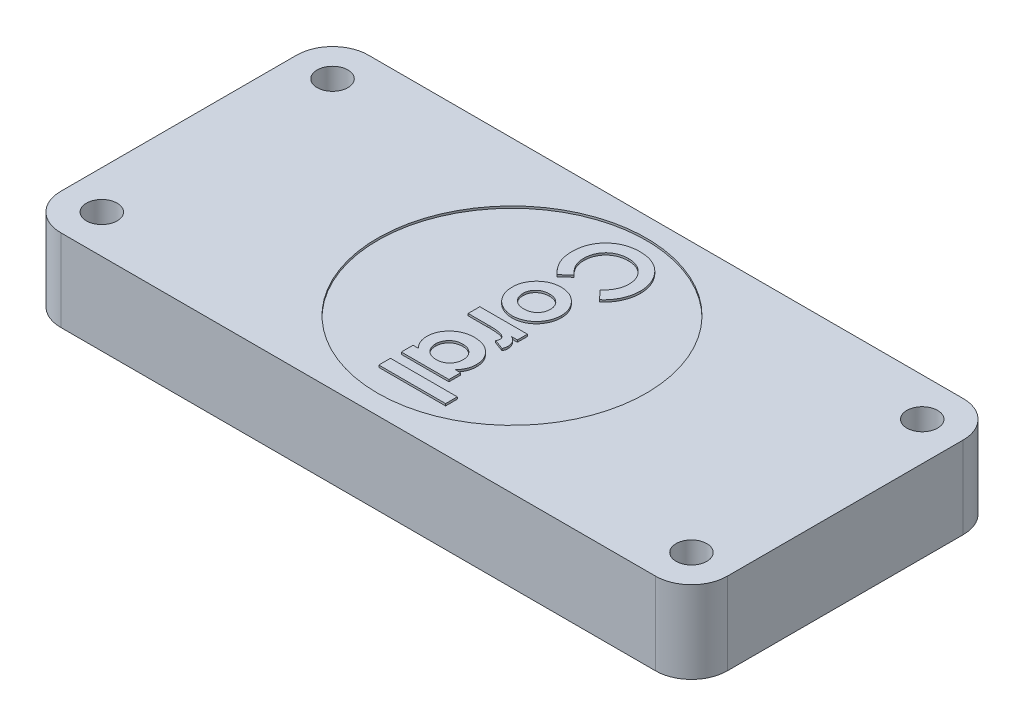
from build123d import *

# Parameters (mm, degrees)
SKETCH1_W           = 65
SKETCH1_H           = 30
SKETCH1_R           = 1.5
BOSS_EXTRUDE1_DEPTH = 8
FILLET1_R           = 3.5
SKETCH2_R           = 13.103694402
SKETCH2_W           = 6.512820512
SKETCH2_H           = 1.13974359
CUT_EXTRUDE1_DEPTH  = 0.2


with BuildPart() as part:
    # Sketch1 → Boss-Extrude1 (new body)
    with BuildSketch(Plane(origin=(0, 0, 0), x_dir=(1, 0, 0), z_dir=(0, 1, 0))):
        Rectangle(SKETCH1_W, SKETCH1_H)
        with Locations(Location((-28.75, 11.25, 0), (0, 0, 270))):
            Circle(SKETCH1_R, mode=Mode.SUBTRACT)
        with Locations(Location((-28.75, -11.25, 0), (0, 0, 90))):
            Circle(SKETCH1_R, mode=Mode.SUBTRACT)
        with Locations(Location((28.75, 11.25, 0), (0, 0, 90))):
            Circle(SKETCH1_R, mode=Mode.SUBTRACT)
        with Locations(Location((28.75, -11.25, 0), (0, 0, 270))):
            Circle(SKETCH1_R, mode=Mode.SUBTRACT)
    extrude(amount=BOSS_EXTRUDE1_DEPTH)

    # Fillet1
    fillet1_edges = [part.edges().sort_by_distance(p)[0] for p in [
        (32.5, 4, 15),
        (-32.5, 4, 15),
        (-32.5, 4, -15),
        (32.5, 4, -15),
    ]]
    fillet(fillet1_edges, radius=FILLET1_R)

    # Sketch2 → Cut-Extrude1 (cut)
    # profile 1 of 3: a face of its own
    with BuildSketch(Plane(origin=(0, 8, 0), x_dir=(1, 0, 0), z_dir=(0, 1, 0))):
        with Locations(Location((0, 0, 0), (0, 0, 270))):
            Circle(SKETCH2_R)
        with Locations((0.932401843, -10.094871795)):
            Rectangle(SKETCH2_W, SKETCH2_H, mode=Mode.SUBTRACT)
        with BuildLine():
            add(Edge.make_bspline(
                [(0.861167869, 11.641666667), (1.015981783, 11.643008743), (1.24450499, 11.62762944), (1.5440518, 11.586339476), (1.758185007, 11.538226112), (1.967155075, 11.480132902), (2.168693631, 11.407912517), (2.363379156, 11.321652587), (2.551537767, 11.22414076), (2.73193677, 11.113826154), (2.903026267, 10.990592748), (3.066127035, 10.857612913), (3.21907524, 10.711691396), (3.363213796, 10.55494862), (3.497761593, 10.386676911), (3.624648177, 10.207888339), (3.740601531, 10.018098985), (3.845487275, 9.820995971), (3.938001815, 9.619065212), (4.015319611, 9.412803096), (4.079463181, 9.203080722), (4.127300543, 8.989015728), (4.176094506, 8.698007977), (4.187181091, 8.475380047), (4.188812099, 8.326742788)],
                knots=[0, 0, 0, 0, 0.088511806, 0.130925591, 0.172904037, 0.21400012, 0.25498502, 0.295291276, 0.335772442, 0.376180821, 0.416178408, 0.456350051, 0.496512167, 0.537040574, 0.578118744, 0.619724561, 0.66242197, 0.705298954, 0.747430001, 0.789432984, 0.831267421, 0.872825096, 0.91487011, 1, 1, 1, 1], degree=3))
            add(Edge.make_bspline(
                [(4.188812099, 8.326742788), (4.18893928, 8.199278713), (4.178639511, 8.008968181), (4.145000479, 7.757165377), (4.107331929, 7.571080942), (4.062552649, 7.385857795), (4.003938383, 7.20392949), (3.938597472, 7.022426151), (3.860497008, 6.844194308), (3.775242879, 6.668985361), (3.678519467, 6.500903198), (3.576277074, 6.337128185), (3.462471621, 6.181280406), (3.34120512, 6.030474623), (3.168053114, 5.836002635), (3.023707646, 5.702842213), (2.924409054, 5.617307692)],
                knots=[0, 0, 0, 0, 0.123904062, 0.185067241, 0.246840152, 0.30843533, 0.370241251, 0.432586589, 0.495924582, 0.559351071, 0.621942654, 0.684392867, 0.746985808, 0.809441465, 0.872507833, 1, 1, 1, 1], degree=3))
            Line((2.924409054, 5.617307692), (2.125570913, 6.453034856))
            add(Edge.make_bspline(
                [(2.125570913, 6.453034856), (2.270544811, 6.589015725), (2.474336548, 6.800961027), (2.689567452, 7.117633668), (2.822678529, 7.354047813), (2.92321409, 7.599171541), (3.021832779, 7.934609668), (3.049394057, 8.196549275), (3.04906851, 8.371264022)],
                knots=[0, 0, 0, 0, 0.272304448, 0.399525336, 0.522810878, 0.642662717, 0.761022621, 1, 1, 1, 1], degree=3))
            add(Edge.make_bspline(
                [(3.04906851, 8.371264022), (3.048036764, 8.516024709), (3.031411266, 8.731009319), (2.96354227, 9.006002515), (2.894662328, 9.201005753), (2.805445184, 9.386890371), (2.69605268, 9.5640407), (2.567447887, 9.732021406), (2.420302986, 9.888613279), (2.259535715, 10.031857712), (2.087997448, 10.158424488), (1.906081429, 10.264440114), (1.715628547, 10.351461459), (1.515762765, 10.419187845), (1.23287251, 10.484906656), (1.012193438, 10.500326903), (0.863711939, 10.501923077)],
                knots=[0, 0, 0, 0, 0.127706968, 0.188882163, 0.249158299, 0.309661029, 0.370224886, 0.432332222, 0.495781859, 0.559304077, 0.621860558, 0.683321537, 0.744522975, 0.806088371, 0.868994315, 1, 1, 1, 1], degree=3))
            add(Edge.make_bspline(
                [(0.863711939, 10.501923077), (0.759206696, 10.502427776), (0.60407157, 10.494491057), (0.401536113, 10.465612962), (0.256352994, 10.43487529), (0.1158728, 10.396387489), (-0.021115922, 10.351244904), (-0.152720417, 10.294610743), (-0.280469154, 10.231746803), (-0.400876357, 10.158636535), (-0.515694618, 10.079810237), (-0.624361109, 9.994335971), (-0.726431598, 9.901660134), (-0.820310951, 9.800478423), (-0.90882224, 9.693406013), (-0.989749696, 9.578636739), (-1.065124402, 9.458554654), (-1.130602708, 9.332122385), (-1.189914691, 9.202770392), (-1.23808013, 9.068537214), (-1.27692352, 8.931058051), (-1.309886906, 8.790821085), (-1.337481449, 8.596875468), (-1.348880386, 8.44924497), (-1.347085337, 8.349639423)],
                knots=[0, 0, 0, 0, 0.090639062, 0.134485273, 0.177331356, 0.219264833, 0.260785002, 0.302316572, 0.343435729, 0.384181474, 0.424375739, 0.464181122, 0.504011983, 0.543822462, 0.583802465, 0.624418535, 0.66554756, 0.70667494, 0.747826979, 0.788895117, 0.830219358, 0.871706937, 0.913733854, 1, 1, 1, 1], degree=3))
            add(Edge.make_bspline(
                [(-1.347085337, 8.349639423), (-1.346463629, 8.182916819), (-1.324283414, 7.935120966), (-1.239897428, 7.619515948), (-1.166645404, 7.433045795), (-1.094224556, 7.286948907), (-1.027250735, 7.175727573), (-0.95232872, 7.060717199), (-0.8666411, 6.943821811), (-0.77118892, 6.823752368), (-0.624453233, 6.657814836), (-0.50704784, 6.534182518), (-0.42358774, 6.453034856)],
                knots=[0, 0, 0, 0, 0.229969726, 0.340703508, 0.449355147, 0.505556512, 0.56530267, 0.628204956, 0.694728992, 0.765018834, 0.839580202, 1, 1, 1, 1], degree=3))
            Line((-0.42358774, 6.453034856), (-1.274579327, 5.642748397))
            add(Edge.make_bspline(
                [(-1.274579327, 5.642748397), (-1.381938819, 5.75376993), (-1.539177816, 5.917256717), (-1.72625556, 6.146067386), (-1.852725058, 6.309295362), (-1.965028432, 6.470943324), (-2.063278593, 6.630989995), (-2.14996022, 6.787624604), (-2.223611597, 6.94409946), (-2.286149047, 7.101388298), (-2.339990499, 7.263220018), (-2.385535324, 7.430089393), (-2.422295811, 7.603015449), (-2.451727391, 7.780385763), (-2.47876441, 8.027965297), (-2.487581948, 8.216729622), (-2.486828926, 8.344551282)],
                knots=[0, 0, 0, 0, 0.151815657, 0.222539839, 0.290277535, 0.354640607, 0.415797753, 0.474709008, 0.5304261, 0.585579746, 0.640906165, 0.697901091, 0.755420321, 0.814521258, 0.874461831, 1, 1, 1, 1], degree=3))
            add(Edge.make_bspline(
                [(-2.486828926, 8.344551282), (-2.485407305, 8.576064045), (-2.460811056, 8.918659681), (-2.360687505, 9.356930222), (-2.256993365, 9.663333067), (-2.124399726, 9.953439425), (-1.961879029, 10.227168486), (-1.76982772, 10.484080748), (-1.550506289, 10.722100614), (-1.308283601, 10.937400306), (-1.048202979, 11.127702603), (-0.768986325, 11.285112235), (-0.474757531, 11.415844517), (-0.164178017, 11.517955843), (0.280132838, 11.616141656), (0.626587725, 11.642120162), (0.861167869, 11.641666667)],
                knots=[0, 0, 0, 0, 0.131836579, 0.194461068, 0.255345968, 0.31558834, 0.375627452, 0.436137852, 0.49777862, 0.559470361, 0.62027777, 0.680787689, 0.741491622, 0.803215436, 0.866492763, 1, 1, 1, 1], degree=3))
        make_face(mode=Mode.SUBTRACT)
        with BuildLine():
            add(Edge.make_bspline(
                [(-0.007632212, 4.803205128), (0.164241203, 4.802936313), (0.41875111, 4.779736647), (0.744888514, 4.697212172), (0.974697824, 4.610192474), (1.19346598, 4.498832871), (1.474027124, 4.315496038), (1.660200467, 4.141625852), (1.775761218, 4.015815304)],
                knots=[0, 0, 0, 0, 0.256473689, 0.3792365, 0.500977689, 0.622366534, 0.744855131, 1, 1, 1, 1], degree=3))
            add(Edge.make_bspline(
                [(1.775761218, 4.015815304), (1.877612424, 3.905167025), (2.011792511, 3.726614171), (2.157280012, 3.471233194), (2.24615025, 3.275709153), (2.313008872, 3.072898694), (2.378786976, 2.792331554), (2.397170862, 2.575294863), (2.397786458, 2.42958734)],
                knots=[0, 0, 0, 0, 0.25846437, 0.382579777, 0.504990606, 0.627227493, 0.749296729, 1, 1, 1, 1], degree=3))
            add(Edge.make_bspline(
                [(2.397786458, 2.42958734), (2.397773344, 2.322903773), (2.388066956, 2.16322058), (2.353297812, 1.953882401), (2.319940824, 1.79960193), (2.27313793, 1.648634299), (2.217020337, 1.500188789), (2.152586786, 1.352937817), (2.07588944, 1.210536201), (1.992703892, 1.071955175), (1.900943483, 0.940572115), (1.801328872, 0.817478067), (1.696169724, 0.700387986), (1.580887748, 0.59475846), (1.461037714, 0.493839188), (1.332325813, 0.403082622), (1.197888459, 0.319055026), (1.058503063, 0.244246194), (0.915139292, 0.179287262), (0.769779062, 0.122913525), (0.620652484, 0.078757698), (0.4697234, 0.042262422), (0.262666443, 0.011113871), (0.105541426, -0.000624242), (0, 0)],
                knots=[0, 0, 0, 0, 0.084364343, 0.126142289, 0.167705805, 0.209066008, 0.25097289, 0.293148456, 0.336041456, 0.37876116, 0.420892731, 0.462622223, 0.503914433, 0.545187585, 0.586138136, 0.627721928, 0.669584534, 0.711432369, 0.752690541, 0.793970501, 0.834591739, 0.875576584, 0.916639513, 1, 1, 1, 1], degree=3))
            add(Edge.make_bspline(
                [(0, 0), (-0.106248238, 0.000139387), (-0.265116701, 0.009616766), (-0.47316723, 0.044485907), (-0.62657709, 0.077972911), (-0.776131374, 0.12460024), (-0.924033196, 0.179065062), (-1.068266966, 0.245926761), (-1.21040604, 0.319846295), (-1.346267725, 0.404414133), (-1.476269008, 0.495092144), (-1.596999347, 0.595588715), (-1.712202926, 0.700372648), (-1.817984073, 0.814414087), (-1.9160604, 0.935892717), (-2.007630905, 1.06375687), (-2.090547277, 1.198926023), (-2.163402632, 1.339668893), (-2.229088812, 1.483611847), (-2.283773105, 1.631596699), (-2.328382091, 1.783316755), (-2.362863969, 1.938865649), (-2.394615089, 2.152474293), (-2.405971679, 2.315182718), (-2.40541867, 2.424499199)],
                knots=[0, 0, 0, 0, 0.083839067, 0.125192329, 0.166335368, 0.207601958, 0.248670144, 0.290582404, 0.332926248, 0.374978427, 0.416740924, 0.457856759, 0.498808992, 0.539515963, 0.580420356, 0.621910028, 0.663502052, 0.705394285, 0.746863727, 0.788245389, 0.82973641, 0.871532383, 0.913824669, 1, 1, 1, 1], degree=3))
            add(Edge.make_bspline(
                [(-2.40541867, 2.424499199), (-2.403821135, 2.583285211), (-2.385877628, 2.819786411), (-2.311356413, 3.12321), (-2.234723971, 3.339294453), (-2.13642866, 3.546822244), (-2.014797737, 3.743976122), (-1.872199635, 3.932718851), (-1.709846752, 4.109780955), (-1.531730505, 4.271993441), (-1.341592514, 4.413707044), (-1.142282952, 4.534028), (-0.933572862, 4.63287396), (-0.71518242, 4.709090336), (-0.407990513, 4.783798649), (-0.168520779, 4.801651136), (-0.007632212, 4.803205128)],
                knots=[0, 0, 0, 0, 0.126883986, 0.188200706, 0.248894086, 0.309598788, 0.371125298, 0.433465539, 0.498143129, 0.562592753, 0.625474489, 0.687114454, 0.748124994, 0.809456656, 0.871431117, 1, 1, 1, 1], degree=3))
        make_face(mode=Mode.SUBTRACT)
        with BuildLine():
            add(Edge.make_bspline(
                [(1.317828526, -2.902784455), (1.346269587, -2.843494492), (1.397393829, -2.738868824), (1.420282537, -2.624407485), (1.420863381, -2.574599359)],
                knots=[0, 0, 0, 0, 0.570645018, 1, 1, 1, 1], degree=3))
            add(Edge.make_bspline(
                [(1.420863381, -2.574599359), (1.420806703, -2.532059477), (1.411399745, -2.466882792), (1.374533722, -2.387768586), (1.339310877, -2.329211959), (1.290279658, -2.276078498), (1.233534653, -2.222979308), (1.163469903, -2.176185064), (1.085485809, -2.12680369), (0.990032841, -2.084757242), (0.876081832, -2.048703425), (0.742314078, -2.016580554), (0.588019524, -1.994469651), (0.414690659, -1.973126548), (0.143596749, -1.955180696), (-0.069853668, -1.949027146), (-0.218790064, -1.950030048)],
                knots=[0, 0, 0, 0, 0.066912404, 0.101140702, 0.136380892, 0.173597996, 0.214075626, 0.25797978, 0.305417223, 0.358684712, 0.420923911, 0.492691001, 0.574130849, 0.665182153, 0.766512664, 1, 1, 1, 1], degree=3))
            Line((-0.218790064, -1.950030048), (-0.44521234, -1.953846154))
            Line((-0.44521234, -1.953846154), (-2.324008413, -1.953846154))
            Line((-2.324008413, -1.953846154), (-2.324008413, -0.814102564))
            Line((-2.324008413, -0.814102564), (2.316376202, -0.814102564))
            Line((2.316376202, -0.814102564), (2.316376202, -1.791025641))
            Line((2.316376202, -1.791025641), (1.745232372, -1.791025641))
            add(Edge.make_bspline(
                [(1.745232372, -1.791025641), (1.845220751, -1.842556491), (1.987806121, -1.930402954), (2.140497806, -2.085938373), (2.234016922, -2.210563371), (2.306771724, -2.34629825), (2.37674953, -2.537873243), (2.398932443, -2.690200201), (2.397786458, -2.792117388)],
                knots=[0, 0, 0, 0, 0.268422379, 0.39320538, 0.516430377, 0.637792883, 0.758061252, 1, 1, 1, 1], degree=3))
            add(Edge.make_bspline(
                [(2.397786458, -2.792117388), (2.396060909, -2.868115109), (2.378737278, -3.029329585), (2.317690019, -3.179598757), (2.283303285, -3.256410256)],
                knots=[0, 0, 0, 0, 0.474167851, 1, 1, 1, 1], degree=3))
            Line((2.283303285, -3.256410256), (1.317828526, -2.902784455))
        make_face(mode=Mode.SUBTRACT)
        with BuildLine():
            add(Edge.make_bspline(
                [(-0.012720353, -3.663461538), (0.156045959, -3.664802024), (0.406094287, -3.680034509), (0.726104406, -3.749794942), (0.949834735, -3.81955033), (1.161646727, -3.909354378), (1.361880786, -4.018710839), (1.550015217, -4.14912783), (1.722847562, -4.29940901), (1.881256251, -4.46167608), (2.019165448, -4.635273155), (2.136319018, -4.817485286), (2.231986205, -5.008507441), (2.305823445, -5.208307322), (2.379064737, -5.488525244), (2.39792752, -5.707710857), (2.397786458, -5.855178285)],
                knots=[0, 0, 0, 0, 0.139308968, 0.205473642, 0.26959838, 0.332253223, 0.394830003, 0.45737553, 0.520581844, 0.583374035, 0.644082429, 0.703039519, 0.761664045, 0.819843943, 0.878346403, 1, 1, 1, 1], degree=3))
            add(Edge.make_bspline(
                [(2.397786458, -5.855178285), (2.399385687, -5.99221338), (2.379105816, -6.195379182), (2.315794611, -6.45799979), (2.249311548, -6.646153515), (2.165150347, -6.82864604), (2.022986959, -7.063957964), (1.891940994, -7.226659369), (1.793569712, -7.326923077)],
                knots=[0, 0, 0, 0, 0.251537451, 0.373434128, 0.49566655, 0.617680221, 0.742091207, 1, 1, 1, 1], degree=3))
            Line((1.793569712, -7.326923077), (2.316376202, -7.326923077))
            Line((2.316376202, -7.326923077), (2.316376202, -8.466666667))
            Line((2.316376202, -8.466666667), (-2.324008413, -8.466666667))
            Line((-2.324008413, -8.466666667), (-2.324008413, -7.326923077))
            Line((-2.324008413, -7.326923077), (-1.817738381, -7.326923077))
            add(Edge.make_bspline(
                [(-1.817738381, -7.326923077), (-1.915117736, -7.219105365), (-2.048735672, -7.052868149), (-2.189096918, -6.814912643), (-2.270669293, -6.640399629), (-2.330810421, -6.461831998), (-2.3899556, -6.213440936), (-2.404545398, -6.019774106), (-2.40541867, -5.889523237)],
                knots=[0, 0, 0, 0, 0.273943506, 0.399987178, 0.519718967, 0.636176176, 0.754371141, 1, 1, 1, 1], degree=3))
            add(Edge.make_bspline(
                [(-2.40541867, -5.889523237), (-2.406995335, -5.742600806), (-2.384504248, -5.524784777), (-2.31232767, -5.244598938), (-2.237070707, -5.044044492), (-2.139399027, -4.851439723), (-2.022018594, -4.665309745), (-1.880765258, -4.488845663), (-1.721762525, -4.320578271), (-1.546857626, -4.166514066), (-1.358479041, -4.031828208), (-1.159298606, -3.918303431), (-0.949975462, -3.825278683), (-0.730668115, -3.752177446), (-0.41942263, -3.681277763), (-0.176555831, -3.664019756), (-0.012720353, -3.663461538)],
                knots=[0, 0, 0, 0, 0.121092325, 0.179634237, 0.238303512, 0.297437091, 0.357506849, 0.419513154, 0.483600041, 0.548295031, 0.611486872, 0.674312645, 0.737107248, 0.800159515, 0.864737133, 1, 1, 1, 1], degree=3))
        make_face(mode=Mode.SUBTRACT)
    # profile 2 of 3: a face of its own
    with BuildSketch(Plane(origin=(0, 8, 0), x_dir=(1, 0, 0), z_dir=(0, 1, 0))):
        with BuildLine():
            add(Edge.make_bspline(
                [(-1.347085337, 2.40796274), (-1.346800068, 2.320580503), (-1.335431396, 2.191196091), (-1.295959625, 2.02541106), (-1.25511353, 1.908369232), (-1.201472814, 1.797583874), (-1.135788548, 1.692631777), (-1.059500153, 1.592589455), (-0.970169174, 1.500756421), (-0.873276665, 1.415748679), (-0.768191155, 1.34120071), (-0.65584356, 1.278910287), (-0.536941178, 1.227803456), (-0.41164599, 1.188209713), (-0.232095585, 1.150700577), (-0.092540769, 1.13814623), (0.002544071, 1.13974359)],
                knots=[0, 0, 0, 0, 0.126396675, 0.18693923, 0.24609921, 0.305348133, 0.364571657, 0.424924428, 0.486952233, 0.549550456, 0.611149272, 0.672921868, 0.735010283, 0.798048595, 0.862642915, 1, 1, 1, 1], degree=3))
            add(Edge.make_bspline(
                [(0.002544071, 1.13974359), (0.09744292, 1.139356578), (0.237253352, 1.149042514), (0.416393634, 1.18674959), (0.540492308, 1.22679371), (0.65838308, 1.276275114), (0.769461011, 1.337373669), (0.873179397, 1.410729126), (0.969023878, 1.493889622), (1.05547039, 1.585864931), (1.132560114, 1.683431952), (1.196317716, 1.788821377), (1.248882409, 1.900057658), (1.289302223, 2.017430533), (1.330065509, 2.184635867), (1.337554128, 2.315782603), (1.339453125, 2.404146635)],
                knots=[0, 0, 0, 0, 0.137840339, 0.202697511, 0.265405501, 0.326938422, 0.388125269, 0.449116585, 0.511100798, 0.572085896, 0.632197341, 0.691338952, 0.750563856, 0.810545842, 0.871334761, 1, 1, 1, 1], degree=3))
            add(Edge.make_bspline(
                [(1.339453125, 2.404146635), (1.337115252, 2.49070307), (1.330884888, 2.620202586), (1.287839293, 2.783953713), (1.2474632, 2.900360542), (1.193449035, 3.010188445), (1.130244061, 3.116435684), (1.051149659, 3.213580135), (0.964389175, 3.306322351), (0.868043897, 3.390511301), (0.763075842, 3.462249543), (0.653500697, 3.526344501), (0.535307337, 3.574961849), (0.411724254, 3.615129721), (0.234181227, 3.652328959), (0.096383736, 3.665037337), (0.002544071, 3.663461538)],
                knots=[0, 0, 0, 0, 0.126802865, 0.187422712, 0.246517508, 0.306285303, 0.365703059, 0.4264774, 0.488621826, 0.550895458, 0.612678531, 0.673914015, 0.735734248, 0.798735035, 0.86329015, 1, 1, 1, 1], degree=3))
            add(Edge.make_bspline(
                [(0.002544071, 3.663461538), (-0.09360549, 3.66384808), (-0.235156486, 3.654349364), (-0.416726411, 3.616221873), (-0.542678813, 3.576687664), (-0.662164917, 3.526910629), (-0.774512332, 3.465854222), (-0.879046064, 3.392858769), (-0.975637297, 3.310100578), (-1.063314101, 3.219483673), (-1.138555534, 3.120192727), (-1.20392858, 3.016386008), (-1.256439683, 2.905669728), (-1.296958346, 2.789622102), (-1.337543848, 2.624501657), (-1.345371286, 2.495084849), (-1.347085337, 2.40796274)],
                knots=[0, 0, 0, 0, 0.139455827, 0.204809025, 0.268587499, 0.330586987, 0.392213478, 0.453609543, 0.515091734, 0.576401551, 0.636039465, 0.695407414, 0.753980593, 0.813284842, 0.873377339, 1, 1, 1, 1], degree=3))
        make_face()
    # profile 3 of 3: a face of its own
    with BuildSketch(Plane(origin=(0, 8, 0), x_dir=(1, 0, 0), z_dir=(0, 1, 0))):
        with BuildLine():
            add(Edge.make_bspline(
                [(-1.347085337, -6.099409054), (-1.345579608, -6.18998759), (-1.337120111, -6.32419763), (-1.297586473, -6.496193234), (-1.254601848, -6.616194288), (-1.202877645, -6.731249593), (-1.138909958, -6.840317293), (-1.061969133, -6.942214779), (-0.974058257, -7.037457901), (-0.877511719, -7.124729754), (-0.771641459, -7.200188476), (-0.659833764, -7.265914139), (-0.539443891, -7.317610452), (-0.412582704, -7.358641191), (-0.230270339, -7.398774405), (-0.087540149, -7.40659951), (0.008904247, -7.408333333)],
                knots=[0, 0, 0, 0, 0.128661741, 0.189789734, 0.249707447, 0.309188905, 0.368499841, 0.428643518, 0.489936978, 0.552121002, 0.612878024, 0.674050383, 0.735729182, 0.798304624, 0.862952782, 1, 1, 1, 1], degree=3))
            add(Edge.make_bspline(
                [(0.008904247, -7.408333333), (0.103225881, -7.406690306), (0.243065139, -7.398794803), (0.42184693, -7.358362145), (0.546492816, -7.318177297), (0.664014, -7.265561182), (0.77310241, -7.199785848), (0.877538866, -7.125154842), (0.971477141, -7.036916765), (1.058751493, -6.942189603), (1.133365521, -6.838793522), (1.197668206, -6.729986439), (1.250469679, -6.615098266), (1.289151004, -6.493071193), (1.329958119, -6.320549468), (1.337792787, -6.185233617), (1.339453125, -6.094320913)],
                knots=[0, 0, 0, 0, 0.135095843, 0.199062931, 0.26154836, 0.322044302, 0.382646423, 0.443384787, 0.505154721, 0.566515904, 0.627254268, 0.687026267, 0.746970113, 0.807538884, 0.869732605, 1, 1, 1, 1], degree=3))
            add(Edge.make_bspline(
                [(1.339453125, -6.094320913), (1.33805364, -6.005415524), (1.329274417, -5.873348466), (1.28993282, -5.703885148), (1.24719503, -5.58547419), (1.195096418, -5.47198713), (1.129853959, -5.365150512), (1.052736129, -5.26408173), (0.965612861, -5.169375378), (0.869848302, -5.08303667), (0.765348366, -5.008607312), (0.654929151, -4.945355702), (0.538256883, -4.891856338), (0.413957811, -4.853581276), (0.237262099, -4.812386131), (0.098489211, -4.805229746), (0.005088141, -4.803205128)],
                knots=[0, 0, 0, 0, 0.128420809, 0.189995948, 0.250359009, 0.30974405, 0.369855539, 0.430536995, 0.492876096, 0.555257199, 0.616197084, 0.67757746, 0.738630831, 0.800921896, 0.864881541, 1, 1, 1, 1], degree=3))
            add(Edge.make_bspline(
                [(0.005088141, -4.803205128), (-0.089269882, -4.804895074), (-0.228974478, -4.813028297), (-0.408133043, -4.852748911), (-0.532948652, -4.89538034), (-0.652048706, -4.947474445), (-0.764879588, -5.010876517), (-0.869447322, -5.088757049), (-0.968226152, -5.17517141), (-1.056431543, -5.271820666), (-1.134750859, -5.373461293), (-1.200276886, -5.48148168), (-1.253249012, -5.59470982), (-1.296366125, -5.712764778), (-1.335168052, -5.880645682), (-1.34669767, -6.011153359), (-1.347085337, -6.099409054)],
                knots=[0, 0, 0, 0, 0.135364742, 0.199460916, 0.262263612, 0.323991109, 0.385461119, 0.447170687, 0.510418175, 0.573170928, 0.634270788, 0.693953647, 0.753722967, 0.813083582, 0.873628543, 1, 1, 1, 1], degree=3))
        make_face()
    extrude(amount=-CUT_EXTRUDE1_DEPTH, mode=Mode.SUBTRACT)


solid = part.part
